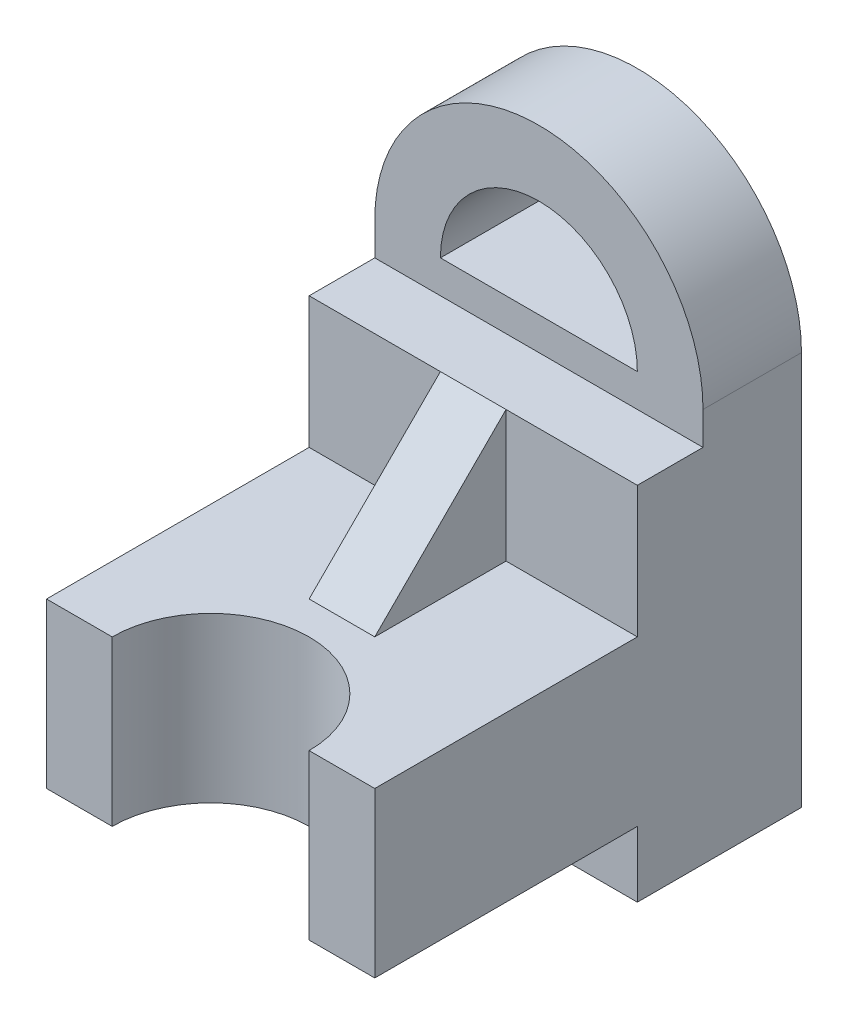
from build123d import *

# Parameters (mm, degrees)
BOSS_EXTRUDE1_DEPTH     = 15
SKETCH3_3_W             = 50
SKETCH3_3_H             = 20
BOSS_EXTRUDE2_DEPTH     = 25
SKETCH3_4_W             = 50
SKETCH3_4_H             = 25
BOSS_EXTRUDE3_DEPTH     = 65
SKETCH3_6_W             = 50
SKETCH3_6_H             = 10
BOSS_EXTRUDE4_DEPTH     = 25
CUT_EXTRUDE1_DEPTH      = 86.732140997
CUT_EXTRUDE1_DEPTH_BACK = 86.732140997
BOSS_EXTRUDE5_DEPTH     = 5


with BuildPart() as part:
    # Sketch3 → Boss-Extrude1 (new body)
    with BuildSketch(Plane.XY):
        with BuildLine():
            Line((-25, 20), (25, 20))
            Line((25, 20), (25, 25))
            ThreePointArc((25, 25), (0, 50), (-25, 25))
            Line((-25, 25), (-25, 20))
        make_face()
        with BuildLine():
            ThreePointArc((-15, 25), (0, 40), (15, 25))
            Line((15, 25), (-15, 25))
        make_face(mode=Mode.SUBTRACT)
    extrude(amount=BOSS_EXTRUDE1_DEPTH)

    # Sketch3<3> → Boss-Extrude2 (add)
    with BuildSketch(Plane.XY):
        with Locations((0, 10)):
            Rectangle(SKETCH3_3_W, SKETCH3_3_H)
    extrude(amount=BOSS_EXTRUDE2_DEPTH)

    # Sketch3<4> → Boss-Extrude3 (add)
    with BuildSketch(Plane.XY):
        with Locations((0, -12.5)):
            Rectangle(SKETCH3_4_W, SKETCH3_4_H)
    extrude(amount=BOSS_EXTRUDE3_DEPTH)

    # Sketch3<6> → Boss-Extrude4 (add)
    with BuildSketch(Plane.XY):
        with Locations((0, -30)):
            Rectangle(SKETCH3_6_W, SKETCH3_6_H)
    extrude(amount=BOSS_EXTRUDE4_DEPTH)

    # Sketch5 → Cut-Extrude1 (cut, two sides: drawn at the far end of the back side and taken through both)
    with BuildSketch(Plane(origin=(0, 0, 0), x_dir=(1, 0, 0), z_dir=(0, 1, 0)).offset(-CUT_EXTRUDE1_DEPTH_BACK)):
        with BuildLine():
            Line((-15, -65), (15, -65))
            ThreePointArc((15, -65), (0, -50), (-15, -65))
        make_face()
    extrude(amount=CUT_EXTRUDE1_DEPTH + CUT_EXTRUDE1_DEPTH_BACK, mode=Mode.SUBTRACT)

    # Sketch6 → Boss-Extrude5 (add, symmetric)
    with BuildSketch(Plane(origin=(0, 0, 0), x_dir=(0, 0, -1), z_dir=(1, 0, 0))):
        Polygon((-25, 20), (-45, 0), (-25, 0), align=None)
    extrude(amount=BOSS_EXTRUDE5_DEPTH, both=True)


solid = part.part
